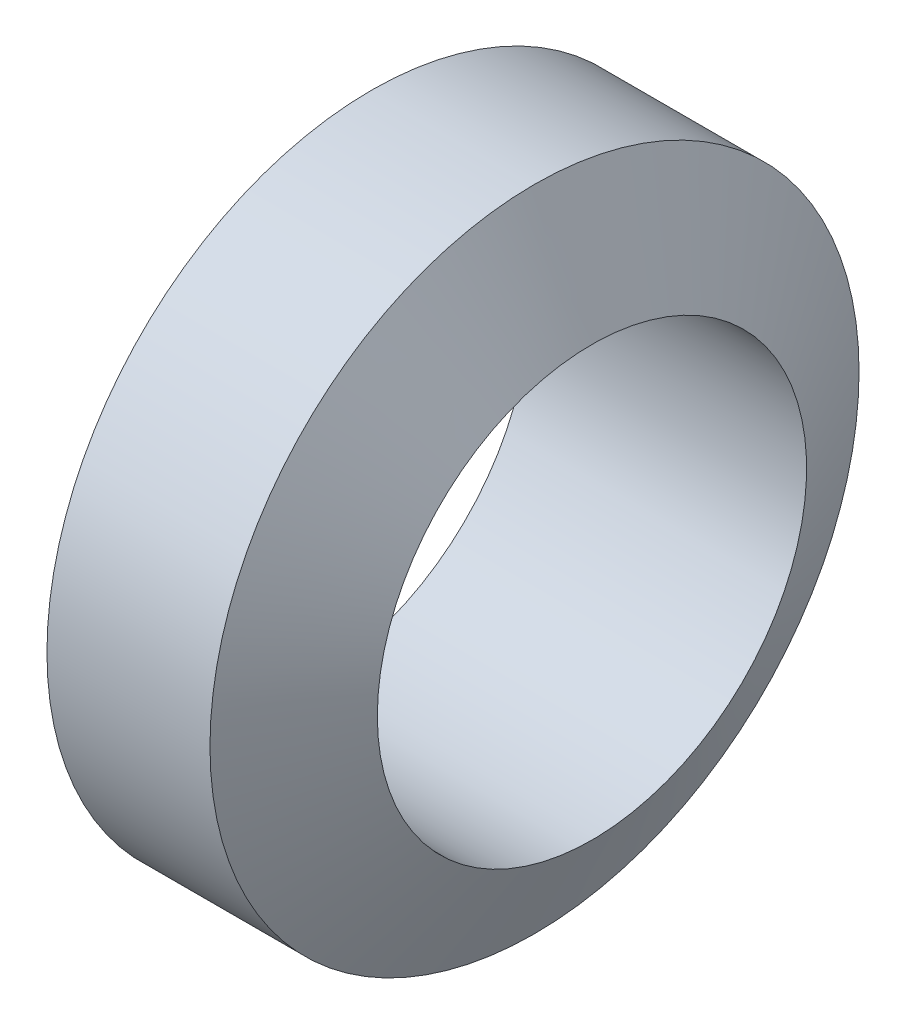
from build123d import *


with BuildPart() as part:
    # Sketch1 → Revolve1 (revolve)
    with BuildSketch(Plane.XY, mode=Mode.PRIVATE) as revolve1_sk:
        Polygon((5.115, 7.9), (3, 11.945), (-3, 11.945), (-5.115, 7.9), align=None)
    revolve(revolve1_sk.sketch.rotate(Axis((-268.372370198, 0, 0), (1, 0, 0)), 90), axis=Axis((-268.372370198, 0, 0), (1, 0, 0)))


solid = part.part
